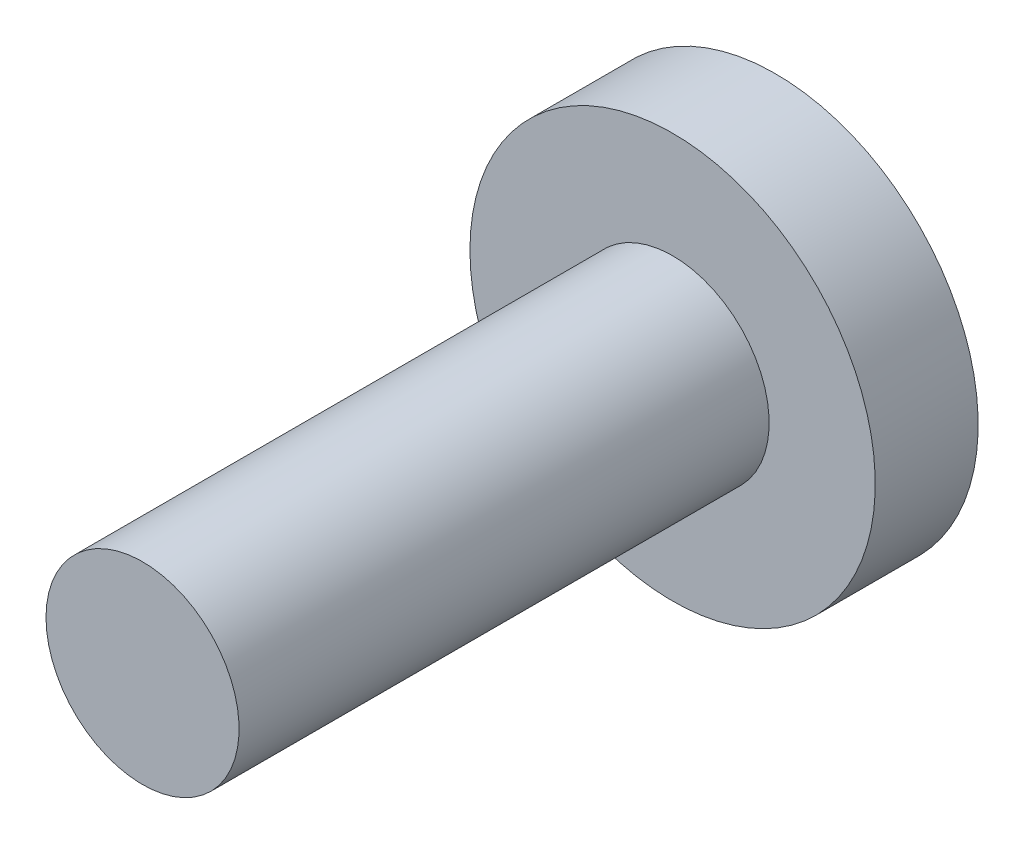
from build123d import *


with BuildPart() as part:
    # Sketch2 → Revolve1 (revolve)
    with BuildSketch(Plane(origin=(0, 0, 0), x_dir=(1, 0, 0), z_dir=(0, 1, 0)), mode=Mode.PRIVATE) as revolve1_sk:
        Polygon((0, 0), (0, -32.482468261), (11.9126, -32.482468261), (11.9126, 32.922531739), (25.0063, 32.922531739), (25.0063, 45.622531739), (0, 45.622531739), align=None)
    revolve(revolve1_sk.sketch.rotate(Axis((0, 0, -45.622531739), (0, 0, 1)), 180), axis=Axis((0, 0, -45.622531739), (0, 0, 1)))


solid = part.part
